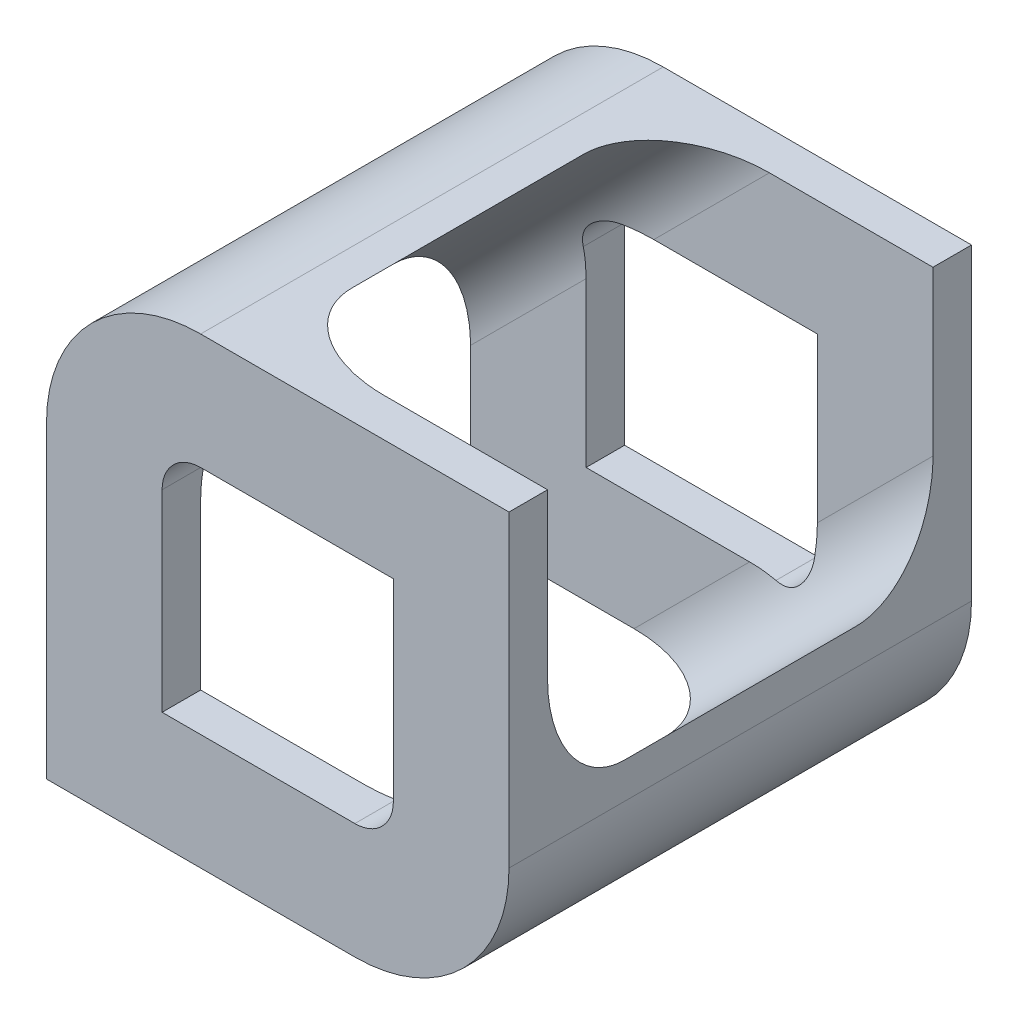
from build123d import *

# Parameters (mm, degrees)
BOSS_EXTRUDE2_DEPTH = 76.2
CUT_EXTRUDE1_DEPTH  = 76.2
CUT_EXTRUDE6_DEPTH  = 204.978


with BuildPart() as part:
    # Sketch1 → Boss-Extrude2 (new body)
    with BuildSketch(Plane.XY):
        with BuildLine():
            Line((0, 0), (0, 50.8))
            ThreePointArc((0, 50.8), (7.439487758, 68.760512242), (25.4, 76.2))
            Line((25.4, 76.2), (76.2, 76.2))
            Line((76.2, 76.2), (76.2, 25.4))
            ThreePointArc((76.2, 25.4), (68.760512242, 7.439487758), (50.8, 0))
            Line((50.8, 0), (0, 0))
        make_face()
    extrude(amount=BOSS_EXTRUDE2_DEPTH)

    # Sketch1<5> → Cut-Extrude1 (cut)
    with BuildSketch(Plane.XY):
        with BuildLine():
            Line((25.4, 57.15), (57.15, 57.15))
            Line((57.15, 57.15), (57.15, 25.4))
            ThreePointArc((57.15, 25.4), (55.290128061, 20.909871939), (50.8, 19.05))
            Line((50.8, 19.05), (19.05, 19.05))
            Line((19.05, 19.05), (19.05, 50.8))
            ThreePointArc((19.05, 50.8), (20.909871939, 55.290128061), (25.4, 57.15))
        make_face()
    extrude(amount=CUT_EXTRUDE1_DEPTH, mode=Mode.SUBTRACT)

    # Sketch6 → Cut-Extrude6 (cut)
    with BuildSketch(Plane(origin=(76.2, 76.2, 0), x_dir=(0, 0, -1), z_dir=(0.7071067811865561, 0.7071067811865389, 0))):
        with BuildLine():
            Line((-19.05, -31.75), (-57.15, -31.75))
            ThreePointArc((-57.15, -31.75), (-66.130256121, -28.030256121), (-69.85, -19.05))
            Line((-69.85, -19.05), (-69.85, 19.05))
            ThreePointArc((-69.85, 19.05), (-66.130256121, 28.030256121), (-57.15, 31.75))
            Line((-57.15, 31.75), (-19.05, 31.75))
            ThreePointArc((-19.05, 31.75), (-10.069743879, 28.030256121), (-6.35, 19.05))
            Line((-6.35, 19.05), (-6.35, -19.05))
            ThreePointArc((-6.35, -19.05), (-10.069743879, -28.030256121), (-19.05, -31.75))
        make_face()
    extrude(amount=-CUT_EXTRUDE6_DEPTH, mode=Mode.SUBTRACT)


solid = part.part
